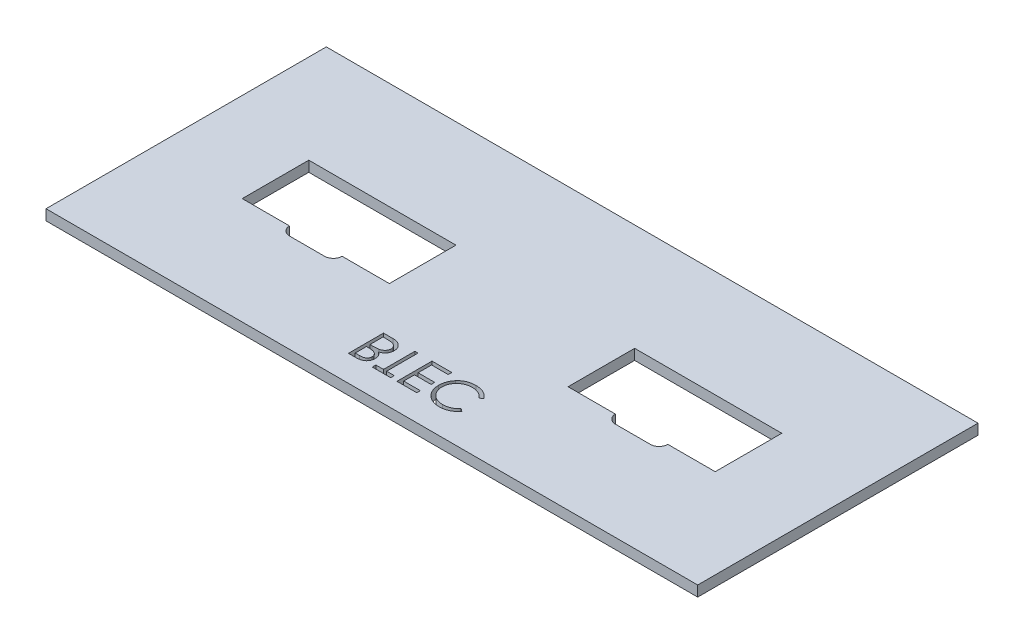
from build123d import *

# Parameters (mm, degrees)
ESQUISSE1_W             = 186
ESQUISSE1_H             = 80
ESQUISSE1_W_2           = 42
ESQUISSE1_H_2           = 19
BOSS_EXTRU_1_DEPTH      = 3
ENL_V_MAT_EXTRU_3_DEPTH = 10
ENL_V_MAT_EXTRU_4_DEPTH = 10
ESQUISSE6_W             = 2.891566265
ESQUISSE6_H             = 4.337349397
BOSS_EXTRU_3_DEPTH      = 3


with BuildPart() as part:
    # Esquisse1 → Boss.-Extru.1 (new body)
    with BuildSketch(Plane(origin=(0, 0, 0), x_dir=(1, 0, 0), z_dir=(0, 1, 0))):
        Rectangle(ESQUISSE1_W, ESQUISSE1_H)
        with Locations((-46.5, 0)):
            Rectangle(ESQUISSE1_W_2, ESQUISSE1_H_2, mode=Mode.SUBTRACT)
        with Locations((46.5, 0)):
            Rectangle(ESQUISSE1_W_2, ESQUISSE1_H_2, mode=Mode.SUBTRACT)
    extrude(amount=BOSS_EXTRU_1_DEPTH)

    # Esquisse3 → Enlèv. mat.-Extru.3 (cut)
    with BuildSketch(Plane(origin=(0, 3, 0), x_dir=(1, 0, 0), z_dir=(0, 1, 0))):
        with BuildLine():
            ThreePointArc((-41.5, -12), (-39.732233047, -11.267766953), (-39, -9.5))
            Line((-39, -9.5), (-54, -9.5))
            ThreePointArc((-54, -9.5), (-53.267766953, -11.267766953), (-51.5, -12))
            Line((-51.5, -12), (-41.5, -12))
        make_face()
        with BuildLine():
            ThreePointArc((-39, -9.5), (-39.732233047, -7.732233047), (-41.5, -7))
            Line((-41.5, -7), (-51.5, -7))
            ThreePointArc((-51.5, -7), (-53.267766953, -7.732233047), (-54, -9.5))
            Line((-54, -9.5), (-39, -9.5))
        make_face()
        with BuildLine():
            Line((54, -9.5), (39, -9.5))
            ThreePointArc((39, -9.5), (39.732233047, -11.267766953), (41.5, -12))
            Line((41.5, -12), (51.5, -12))
            ThreePointArc((51.5, -12), (53.267766953, -11.267766953), (54, -9.5))
        make_face()
    extrude(amount=-ENL_V_MAT_EXTRU_3_DEPTH, mode=Mode.SUBTRACT)

    # Esquisse4 → Enlèv. mat.-Extru.4 (cut)
    # profile 1 of 4: a face of its own
    with BuildSketch(Plane(origin=(0, 3, 0), x_dir=(1, 0, 0), z_dir=(0, 1, 0))):
        with BuildLine():
            Line((-14.099985997, -32.575409602), (-12.148864202, -32.575409602))
            add(Edge.make_bspline(
                [(-12.148864202, -32.575409602), (-12.053352758, -32.574915363), (-11.868227809, -32.573957405), (-11.599049874, -32.558755311), (-11.346839502, -32.538545564), (-11.112042382, -32.504644801), (-10.893130722, -32.469494182), (-10.692326935, -32.417901488), (-10.507949042, -32.360915477), (-10.28654893, -32.273234766), (-10.035340167, -32.137065517), (-9.765337751, -31.935113581), (-9.530635177, -31.692989518), (-9.331068419, -31.417070049), (-9.17091185, -31.113527367), (-9.056511465, -30.788892289), (-8.983016302, -30.448626413), (-8.975552801, -30.215342694), (-8.971780868, -30.097444858)],
                knots=[0, 0, 0, 0, 1.00128172, 1.940733171, 2.826250472, 3.653024905, 4.427672124, 5.149348099, 5.824709082, 6.450061444, 7.643590664, 8.808605388, 9.972104426, 11.165284501, 12.367876273, 13.557044126, 14.765369432, 16, 16, 16, 16], degree=3))
            add(Edge.make_bspline(
                [(-8.971780868, -30.097444858), (-8.974861836, -29.986994881), (-8.980916229, -29.769950261), (-9.040062749, -29.453561609), (-9.129342986, -29.151438809), (-9.258179791, -28.866493405), (-9.422457543, -28.601229204), (-9.622326115, -28.360170941), (-9.859315461, -28.148051377), (-10.037248371, -28.030003821), (-10.127630227, -27.970041012)],
                knots=[0, 0, 0, 0, 1.044356178, 2.052258378, 3.035953355, 4.020338374, 5.002448483, 5.980768927, 6.974322109, 8, 8, 8, 8], degree=3))
            add(Edge.make_bspline(
                [(-10.127630227, -27.970041012), (-10.014020943, -27.926446284), (-9.79665824, -27.843038771), (-9.497152008, -27.695004122), (-9.239020009, -27.535227937), (-9.018935627, -27.3625391), (-8.834520466, -27.171298835), (-8.670236035, -26.966543581), (-8.530812888, -26.741142407), (-8.411853838, -26.499979651), (-8.317619368, -26.24433242), (-8.252207542, -25.97611326), (-8.210723153, -25.698360122), (-8.205298313, -25.509584607), (-8.202550099, -25.413951268)],
                knots=[0, 0, 0, 0, 1.272200328, 2.434034374, 3.488177493, 4.442517805, 5.351202203, 6.260825393, 7.183200622, 8.11705787, 9.069326169, 10.026320267, 11.000137371, 12, 12, 12, 12], degree=3))
            add(Edge.make_bspline(
                [(-8.202550099, -25.413951268), (-8.205341356, -25.316331796), (-8.210833231, -25.12426275), (-8.25134361, -24.842102903), (-8.319955121, -24.572468722), (-8.414392372, -24.31356541), (-8.537496083, -24.066909285), (-8.68621816, -23.830561904), (-8.864716018, -23.608025971), (-9.065722164, -23.396072215), (-9.289987192, -23.202249663), (-9.537109707, -23.035684935), (-9.800756216, -22.891816132), (-10.084537043, -22.776153683), (-10.386438568, -22.685611142), (-10.706531517, -22.623010178), (-11.04463413, -22.580660233), (-11.276665358, -22.57718951), (-11.395659073, -22.575409602)],
                knots=[0, 0, 0, 0, 0.978522333, 1.925270105, 2.85076145, 3.763600118, 4.682725947, 5.609499657, 6.557784645, 7.537954401, 8.534920712, 9.522742111, 10.520247711, 11.5409147, 12.58930695, 13.675078472, 14.807699069, 16, 16, 16, 16], degree=3))
            Line((-11.395659073, -22.575409602), (-14.099985997, -22.575409602))
            Line((-14.099985997, -22.575409602), (-14.099985997, -32.575409602))
        make_face()
        with BuildLine():
            Line((-13.202550099, -31.549768576), (-13.202550099, -28.344640371))
            Line((-13.202550099, -28.344640371), (-12.599585355, -28.344640371))
            add(Edge.make_bspline(
                [(-12.599585355, -28.344640371), (-12.511445146, -28.345773499), (-12.3411403, -28.347962934), (-12.093856614, -28.354432304), (-11.864892837, -28.371753546), (-11.653460052, -28.390073651), (-11.460975209, -28.418282743), (-11.286794455, -28.452803113), (-11.129351374, -28.488991255), (-10.94787285, -28.55071262), (-10.742045085, -28.640975488), (-10.524163127, -28.784486337), (-10.32805957, -28.950640874), (-10.166285454, -29.147726119), (-10.031602632, -29.360560359), (-9.940925917, -29.590730707), (-9.877702739, -29.83030543), (-9.872074399, -29.99552855), (-9.869216766, -30.079416012)],
                knots=[0, 0, 0, 0, 1.156584208, 2.234756387, 3.244705828, 4.168772894, 5.018724976, 5.795346628, 6.498686023, 7.135894168, 8.308330183, 9.43588092, 10.547699294, 11.667188675, 12.76860303, 13.837480448, 14.902040606, 16, 16, 16, 16], degree=3))
            add(Edge.make_bspline(
                [(-9.869216766, -30.079416012), (-9.87061048, -30.134951343), (-9.873344402, -30.243889959), (-9.899118167, -30.402607268), (-9.934685656, -30.553643419), (-9.993345304, -30.692926749), (-10.062841825, -30.825348064), (-10.151919765, -30.946724427), (-10.254634826, -31.060343938), (-10.374387714, -31.163161132), (-10.510688902, -31.256153349), (-10.667856091, -31.33356493), (-10.841616288, -31.402359659), (-11.035592936, -31.454507674), (-11.245922197, -31.499780453), (-11.475812948, -31.528329217), (-11.72387971, -31.546669393), (-11.895755712, -31.548712473), (-11.984601381, -31.549768576)],
                knots=[0, 0, 0, 0, 0.911412742, 1.787835618, 2.63643285, 3.453173233, 4.262886967, 5.08783453, 5.918594724, 6.773969545, 7.67442701, 8.62112486, 9.645634318, 10.739428598, 11.916091468, 13.177237585, 14.540865421, 16, 16, 16, 16], degree=3))
            Line((-11.984601381, -31.549768576), (-13.202550099, -31.549768576))
        make_face(mode=Mode.SUBTRACT)
        with BuildLine():
            Line((-13.202550099, -27.318999345), (-13.202550099, -23.601050627))
            Line((-13.202550099, -23.601050627), (-11.924505227, -23.601050627))
            add(Edge.make_bspline(
                [(-11.924505227, -23.601050627), (-11.833031727, -23.602252477), (-11.656728614, -23.604568885), (-11.401983555, -23.610065401), (-11.167128107, -23.630457456), (-10.950206853, -23.6500081), (-10.752223468, -23.681948138), (-10.571252224, -23.712877116), (-10.411426589, -23.758390635), (-10.224421365, -23.821018042), (-10.015257902, -23.92110494), (-9.786841531, -24.068291297), (-9.585654222, -24.247575126), (-9.414960888, -24.454010278), (-9.273036865, -24.676151776), (-9.174853469, -24.914436836), (-9.111236218, -25.160906348), (-9.10374362, -25.32943316), (-9.099985997, -25.413951268)],
                knots=[0, 0, 0, 0, 1.16016216, 2.236059617, 3.229676189, 4.14889023, 4.996733752, 5.772278665, 6.474820656, 7.101410824, 8.271817372, 9.403828207, 10.537358096, 11.673541442, 12.791884111, 13.865947414, 14.929748409, 16, 16, 16, 16], degree=3))
            add(Edge.make_bspline(
                [(-9.099985997, -25.413951268), (-9.100753043, -25.466797309), (-9.102274762, -25.57163698), (-9.126194682, -25.725566636), (-9.159389411, -25.875412785), (-9.208309119, -26.019140017), (-9.267488663, -26.159223292), (-9.34556156, -26.291104558), (-9.433627209, -26.42039779), (-9.570027582, -26.58577815), (-9.771128529, -26.774024148), (-10.057000624, -26.9560257), (-10.380229733, -27.105181644), (-10.615216497, -27.168237313), (-10.736604586, -27.200810243)],
                knots=[0, 0, 0, 0, 0.723354195, 1.435040621, 2.129761981, 2.824182007, 3.512608497, 4.209435533, 4.920062464, 5.654614313, 7.143585817, 8.671381114, 10.280521501, 12, 12, 12, 12], degree=3))
            add(Edge.make_bspline(
                [(-10.736604586, -27.200810243), (-10.7852591, -27.210682575), (-10.890752123, -27.232087827), (-11.062774655, -27.254668505), (-11.259821379, -27.274924109), (-11.481050081, -27.289513802), (-11.727340618, -27.305175583), (-11.998613865, -27.311049706), (-12.295061601, -27.318219384), (-12.500754346, -27.318732707), (-12.607598176, -27.318999345)],
                knots=[0, 0, 0, 0, 0.634452549, 1.375623993, 2.216454381, 3.166361212, 4.209414599, 5.370755378, 6.634280627, 8, 8, 8, 8], degree=3))
            Line((-12.607598176, -27.318999345), (-13.202550099, -27.318999345))
        make_face(mode=Mode.SUBTRACT)
    # profile 2 of 4: a face of its own
    with BuildSketch(Plane(origin=(0, 3, 0), x_dir=(1, 0, 0), z_dir=(0, 1, 0))):
        Polygon((-7.305114202, -31.549768576), (-7.305114202, -32.575409602), (-2.048703945, -32.575409602), (-2.048703945, -31.549768576), (-4.228191125, -31.549768576), (-4.228191125, -22.575409602), (-5.125627022, -22.575409602), (-5.125627022, -31.549768576), align=None)
    # profile 3 of 4: a face of its own
    with BuildSketch(Plane(origin=(0, 3, 0), x_dir=(1, 0, 0), z_dir=(0, 1, 0))):
        Polygon((-0.25383215, -32.575409602), (5.387193491, -32.575409602), (5.387193491, -31.549768576), (0.643603747, -31.549768576), (0.643603747, -28.472845499), (5.387193491, -28.472845499), (5.387193491, -27.447204473), (0.643603747, -27.447204473), (0.643603747, -23.601050627), (5.387193491, -23.601050627), (5.387193491, -22.575409602), (-0.25383215, -22.575409602), align=None)
    # profile 4 of 4: a face of its own
    with BuildSketch(Plane(origin=(0, 3, 0), x_dir=(1, 0, 0), z_dir=(0, 1, 0))):
        with BuildLine():
            Line((16.412834516, -30.740473704), (15.627578106, -30.139512166))
            add(Edge.make_bspline(
                [(15.627578106, -30.139512166), (15.571560708, -30.206271196), (15.460281147, -30.338889201), (15.281263294, -30.525129448), (15.094655601, -30.699553082), (14.900717708, -30.863280801), (14.694961446, -31.009732047), (14.485226705, -31.150312567), (14.263892894, -31.27339565), (13.959384713, -31.423757033), (13.559482834, -31.57723801), (13.057811857, -31.709244899), (12.533395233, -31.792485408), (12.175701479, -31.801562074), (11.993764003, -31.806178832)],
                knots=[0, 0, 0, 0, 0.75789156, 1.505565099, 2.245254514, 2.979266606, 3.711207489, 4.440978832, 5.174393176, 5.91211879, 7.394186119, 8.890401545, 10.418332761, 12, 12, 12, 12], degree=3))
            add(Edge.make_bspline(
                [(11.993764003, -31.806178832), (11.893527224, -31.805019446), (11.693983956, -31.802711433), (11.397827479, -31.772476505), (11.106640242, -31.729491544), (10.821505068, -31.667261888), (10.542988101, -31.586244524), (10.268968685, -31.49123277), (10.002673963, -31.373000331), (9.740899427, -31.242428218), (9.490112614, -31.094906354), (9.252777879, -30.934046717), (9.029965629, -30.761438405), (8.821109213, -30.577489315), (8.628313179, -30.380051971), (8.449529371, -30.171344698), (8.284985985, -29.95042496), (8.134852792, -29.718348324), (8.000568118, -29.476261177), (7.88412149, -29.225203391), (7.785689908, -28.966134073), (7.705835995, -28.699608439), (7.64333906, -28.426569926), (7.600077871, -28.146040906), (7.570121497, -27.858511731), (7.567833822, -27.663628577), (7.56668067, -27.565393576)],
                knots=[0, 0, 0, 0, 1.054960097, 2.100129169, 3.131228542, 4.15308236, 5.169990287, 6.183953224, 7.204064171, 8.235355279, 9.262684623, 10.264978336, 11.252191258, 12.228402777, 13.192898315, 14.155264692, 15.119862721, 16.091023151, 17.063429752, 18.032246104, 19.00241354, 19.978852882, 20.959535218, 21.948948728, 22.966123959, 24, 24, 24, 24], degree=3))
            add(Edge.make_bspline(
                [(7.56668067, -27.565393576), (7.570294321, -27.4175931), (7.577389245, -27.127406469), (7.640264482, -26.702300809), (7.736577026, -26.294658357), (7.878560001, -25.907239223), (8.057126119, -25.536813798), (8.279927397, -25.18787425), (8.538946953, -24.855308511), (8.836841995, -24.547171131), (9.163724399, -24.265707324), (9.514430427, -24.017847465), (9.888100426, -23.811233794), (10.280604921, -23.639302443), (10.694965291, -23.507140385), (11.130436143, -23.414100026), (11.586070418, -23.353408083), (11.89741156, -23.347597546), (12.055863362, -23.344640371)],
                knots=[0, 0, 0, 0, 1.029159485, 2.020618137, 2.987588728, 3.942669054, 4.889339625, 5.846988364, 6.821327795, 7.821533711, 8.827683044, 9.822769455, 10.807800696, 11.797391277, 12.803701919, 13.832062008, 14.896664671, 16, 16, 16, 16], degree=3))
            add(Edge.make_bspline(
                [(12.055863362, -23.344640371), (12.230442474, -23.349465456), (12.574055928, -23.358962377), (13.077964575, -23.439417375), (13.560352476, -23.569868569), (14.021245581, -23.752434061), (14.45934457, -23.989763455), (14.875335028, -24.277471676), (15.269568087, -24.618295484), (15.506628893, -24.878532993), (15.627578106, -25.011307038)],
                knots=[0, 0, 0, 0, 1.028121516, 2.023589091, 2.998037872, 3.967518031, 4.937445131, 5.927275754, 6.942489185, 8, 8, 8, 8], degree=3))
            Line((15.627578106, -25.011307038), (16.412834516, -24.416355114))
            add(Edge.make_bspline(
                [(16.412834516, -24.416355114), (16.349637785, -24.334819363), (16.22354703, -24.172138411), (16.019412888, -23.942750883), (15.80421677, -23.727173696), (15.57737774, -23.526529564), (15.338599676, -23.339815596), (15.087986939, -23.167899976), (14.826789498, -23.008875645), (14.554680294, -22.864738769), (14.271644432, -22.736481027), (13.980107468, -22.624384052), (13.679535358, -22.530257027), (13.372298361, -22.451170839), (13.055239621, -22.394688194), (12.731986842, -22.349736653), (12.39953034, -22.323062129), (12.175435126, -22.320365755), (12.061872978, -22.318999345)],
                knots=[0, 0, 0, 0, 0.986880684, 1.969034265, 2.935876267, 3.899990983, 4.864973347, 5.834408638, 6.8063673, 7.789580233, 8.778939794, 9.778051223, 10.776304221, 11.791326552, 12.811423977, 13.855999788, 14.91350973, 16, 16, 16, 16], degree=3))
            add(Edge.make_bspline(
                [(12.061872978, -22.318999345), (11.954319643, -22.319747895), (11.741646243, -22.321228061), (11.42764981, -22.345205682), (11.121965293, -22.377919216), (10.825466362, -22.427176733), (10.536535005, -22.485303419), (10.257790478, -22.563221295), (9.986489877, -22.650504628), (9.723723189, -22.753090305), (9.469266904, -22.868850826), (9.223941729, -22.999683852), (8.987860493, -23.144489179), (8.758702148, -23.300074923), (8.539851909, -23.471438643), (8.329413265, -23.656200456), (8.12620619, -23.853737629), (8.000484233, -23.996180067), (7.937273619, -24.067797422)],
                knots=[0, 0, 0, 0, 1.114604814, 2.203992996, 3.262667896, 4.300477797, 5.318619304, 6.316056647, 7.298880507, 8.271930387, 9.238335007, 10.195173496, 11.151986948, 12.108099108, 13.064862484, 14.031167946, 15.010108607, 16, 16, 16, 16], degree=3))
            add(Edge.make_bspline(
                [(7.937273619, -24.067797422), (7.836035527, -24.192203385), (7.634781578, -24.439513374), (7.377182396, -24.840292677), (7.157414073, -25.258367616), (6.977739737, -25.696159753), (6.839728886, -26.153839279), (6.742698287, -26.630669921), (6.680084589, -27.125698471), (6.67289784, -27.462370265), (6.669244773, -27.63350255)],
                knots=[0, 0, 0, 0, 0.994611881, 1.977215934, 2.950189954, 3.921972279, 4.908960509, 5.911694611, 6.938501887, 8, 8, 8, 8], degree=3))
            add(Edge.make_bspline(
                [(6.669244773, -27.63350255), (6.673708057, -27.813367749), (6.68248929, -28.167241299), (6.756479334, -28.686702861), (6.876949419, -29.183667625), (7.042837529, -29.660047794), (7.261688299, -30.113117701), (7.526624856, -30.544790852), (7.840234989, -30.954714773), (8.198580054, -31.337648549), (8.59165029, -31.687751657), (9.012555773, -31.995771821), (9.460505621, -32.252106938), (9.930556242, -32.46638186), (10.426229722, -32.63108028), (10.946467891, -32.746375112), (11.49029337, -32.818138298), (11.861328871, -32.827210321), (12.049853747, -32.831819858)],
                knots=[0, 0, 0, 0, 1.032901378, 2.032168977, 3.007206631, 3.966850309, 4.924221947, 5.891988639, 6.871730993, 7.884084801, 8.900290346, 9.89161143, 10.874607481, 11.860025555, 12.854717796, 13.869097222, 14.917278314, 16, 16, 16, 16], degree=3))
            add(Edge.make_bspline(
                [(12.049853747, -32.831819858), (12.164752086, -32.830442151), (12.392181778, -32.827715119), (12.72862013, -32.801128594), (13.056161538, -32.756794989), (13.375717179, -32.696375651), (13.687814139, -32.621225607), (13.991049831, -32.527127825), (14.2845554, -32.413357387), (14.570309961, -32.286733707), (14.84464966, -32.141715406), (15.107438034, -31.984087036), (15.356541292, -31.810813205), (15.593578726, -31.624421053), (15.817454438, -31.423476693), (16.031528343, -31.211357737), (16.229444116, -30.982437316), (16.351592481, -30.821275884), (16.412834516, -30.740473704)],
                knots=[0, 0, 0, 0, 1.096566765, 2.170543479, 3.218870886, 4.250164525, 5.273529809, 6.281496242, 7.278154839, 8.276706968, 9.263143576, 10.238168486, 11.199979644, 12.157579042, 13.114563119, 14.070017788, 15.032356758, 16, 16, 16, 16], degree=3))
        make_face()
    extrude(amount=-ENL_V_MAT_EXTRU_4_DEPTH, mode=Mode.SUBTRACT)


with BuildPart() as enl_v_mat_extru_4_piece_1:
    # of the separate pieces the step leaves, piece 1, a body of its own (enl_v_mat_extru_4_pieces)
    add(part.part.solids().sort_by_distance((93, 0, 40))[0])

    # Esquisse6 → Boss.-Extru.3 (add)
    # profile 1 of 3: a face of its own
    with BuildSketch(Plane.XZ):
        with BuildLine():
            add(Edge.make_bspline(
                [(-9.108433735, -8.316829819), (-9.114813202, -8.406715931), (-9.126862568, -8.576490411), (-9.190795121, -8.813176808), (-9.284604, -9.019015973), (-9.422904292, -9.185529443), (-9.589417762, -9.323829734), (-9.795256927, -9.417638614), (-10.031943323, -9.481571167), (-10.201717804, -9.493620533), (-10.291603916, -9.5)],
                knots=[0, 0, 0, 0, 1.144701434, 2.162081395, 3.105417678, 4, 4.894582322, 5.837918605, 6.855298566, 8, 8, 8, 8], degree=3))
            Line((-10.291603916, -9.5), (-15.154179217, -9.5))
            add(Edge.make_bspline(
                [(-15.154179217, -9.5), (-15.244065329, -9.493620533), (-15.413839809, -9.481571167), (-15.650526206, -9.417638614), (-15.856365371, -9.323829734), (-16.022878841, -9.185529443), (-16.161179132, -9.019015973), (-16.254988011, -8.813176808), (-16.318920564, -8.576490411), (-16.330969931, -8.406715931), (-16.337349398, -8.316829819)],
                knots=[0, 0, 0, 0, 1.144701434, 2.162081395, 3.105417678, 4, 4.894582322, 5.837918605, 6.855298566, 8, 8, 8, 8], degree=3))
            Line((-16.337349398, -8.316829819), (-16.337349398, -4.981927711))
            Line((-16.337349398, -4.981927711), (-14.168674699, -4.981927711))
            Line((-14.168674699, -4.981927711), (-14.168674699, -7.331325301))
            Line((-14.168674699, -7.331325301), (-11.277108434, -7.331325301))
            Line((-11.277108434, -7.331325301), (-11.277108434, -3.174698795))
            Line((-11.277108434, -3.174698795), (-15.238893072, -3.174698795))
            add(Edge.make_bspline(
                [(-15.238893072, -3.174698795), (-15.322218599, -3.168299318), (-15.479982426, -3.156182912), (-15.699927977, -3.091950595), (-15.891396374, -2.997405026), (-16.046464967, -2.859842023), (-16.171910702, -2.691263542), (-16.261243131, -2.48761739), (-16.317234511, -2.250301182), (-16.330373731, -2.081268671), (-16.337349398, -1.991528614)],
                knots=[0, 0, 0, 0, 1.101013002, 2.084595567, 3.007545748, 3.897505959, 4.795074283, 5.763216275, 6.8124823, 8, 8, 8, 8], degree=3))
            Line((-16.337349398, -1.991528614), (-16.337349398, 4.316829819))
            add(Edge.make_bspline(
                [(-16.337349398, 4.316829819), (-16.330373731, 4.406569876), (-16.317234511, 4.575602387), (-16.261243131, 4.812918595), (-16.171910702, 5.016564747), (-16.046464967, 5.185143228), (-15.891396374, 5.322706231), (-15.699927977, 5.417251799), (-15.479982426, 5.481484117), (-15.322218599, 5.493600523), (-15.238893072, 5.5)],
                knots=[0, 0, 0, 0, 1.1875177, 2.236783725, 3.204925717, 4.102494041, 4.992454252, 5.915404433, 6.898986998, 8, 8, 8, 8], degree=3))
            Line((-15.238893072, 5.5), (-10.311370482, 5.5))
            add(Edge.make_bspline(
                [(-10.311370482, 5.5), (-10.220594097, 5.493482279), (-10.048151236, 5.481100925), (-9.807264894, 5.418392292), (-9.597972504, 5.322837257), (-9.426041654, 5.187511913), (-9.287410471, 5.018833725), (-9.194324958, 4.812781171), (-9.125883722, 4.576997722), (-9.11446857, 4.406805269), (-9.108433735, 4.316829819)],
                knots=[0, 0, 0, 0, 1.146896384, 2.178695418, 3.124832518, 4.030481977, 4.917543956, 5.852950044, 6.864921545, 8, 8, 8, 8], degree=3))
            Line((-9.108433735, 4.316829819), (-9.108433735, -8.316829819))
        make_face()
        with Locations((-12.722891566, 1.162650603)):
            Rectangle(ESQUISSE6_W, ESQUISSE6_H, mode=Mode.SUBTRACT)
    # profile 2 of 3: a face of its own
    with BuildSketch(Plane.XZ):
        with BuildLine():
            add(Edge.make_bspline(
                [(5.873493976, 1.388554217), (5.866904098, 1.267549242), (5.8531976, 1.015867148), (5.755156219, 0.632064538), (5.606454461, 0.228222162), (5.464703829, -0.035292074), (5.390625, -0.173004518)],
                knots=[0, 0, 0, 0, 0.878890772, 1.828032848, 2.864930751, 4, 4, 4, 4], degree=3))
            Line((5.390625, -0.173004518), (1.313064759, -7.331325301))
            Line((1.313064759, -7.331325301), (5.873493976, -7.331325301))
            Line((5.873493976, -7.331325301), (5.873493976, -9.5))
            Line((5.873493976, -9.5), (-1.355421687, -9.5))
            Line((-1.355421687, -9.5), (-1.355421687, -8.144578313))
            Line((-1.355421687, -8.144578313), (3.704819277, 0.739081325))
            Line((3.704819277, 0.739081325), (3.704819277, 3.331325301))
            Line((3.704819277, 3.331325301), (0.993975904, 3.331325301))
            Line((0.993975904, 3.331325301), (0.993975904, 0.801204819))
            Line((0.993975904, 0.801204819), (-1.174698795, 0.801204819))
            Line((-1.174698795, 0.801204819), (-1.174698795, 4.316829819))
            add(Edge.make_bspline(
                [(-1.174698795, 4.316829819), (-1.168319328, 4.406715931), (-1.156269962, 4.576490411), (-1.092337409, 4.813176808), (-0.99852853, 5.019015973), (-0.860228238, 5.185529443), (-0.693714768, 5.323829734), (-0.487875603, 5.417638614), (-0.251189207, 5.481571167), (-0.081414727, 5.493620533), (0.008471386, 5.5)],
                knots=[0, 0, 0, 0, 1.144701434, 2.162081395, 3.105417678, 4, 4.894582322, 5.837918605, 6.855298566, 8, 8, 8, 8], degree=3))
            Line((0.008471386, 5.5), (4.690323795, 5.5))
            add(Edge.make_bspline(
                [(4.690323795, 5.5), (4.780209907, 5.493620533), (4.949984387, 5.481571167), (5.186670784, 5.417638614), (5.392509949, 5.323829734), (5.559023419, 5.185529443), (5.69732371, 5.019015973), (5.791132589, 4.813176808), (5.855065143, 4.576490411), (5.867114509, 4.406715931), (5.873493976, 4.316829819)],
                knots=[0, 0, 0, 0, 1.144701434, 2.162081395, 3.105417678, 4, 4.894582322, 5.837918605, 6.855298566, 8, 8, 8, 8], degree=3))
            Line((5.873493976, 4.316829819), (5.873493976, 1.388554217))
        make_face()
    # profile 3 of 3: a face of its own
    with BuildSketch(Plane.XZ):
        Polygon((16.337349398, -9.5), (14.168674699, -9.5), (14.168674699, 1.162650602), (13.265060241, 1.162650602), (13.265060241, 1.43373494), (14.465173193, 5.5), (16.337349398, 5.5), align=None)
    extrude(amount=BOSS_EXTRU_3_DEPTH)


with BuildPart() as enl_v_mat_extru_4_piece_2:
    # of the separate pieces the step leaves, piece 2, a body of its own (enl_v_mat_extru_4_pieces)
    add(part.part.solids().sort_by_distance((-13.202550099, 0, 23.601050627))[0])


with BuildPart() as enl_v_mat_extru_4_piece_3:
    # of the separate pieces the step leaves, piece 3, a body of its own (enl_v_mat_extru_4_pieces)
    add(part.part.solids().sort_by_distance((-13.202550099, 0, 28.344640371))[0])


solid = Compound([enl_v_mat_extru_4_piece_1.part, enl_v_mat_extru_4_piece_2.part, enl_v_mat_extru_4_piece_3.part])
